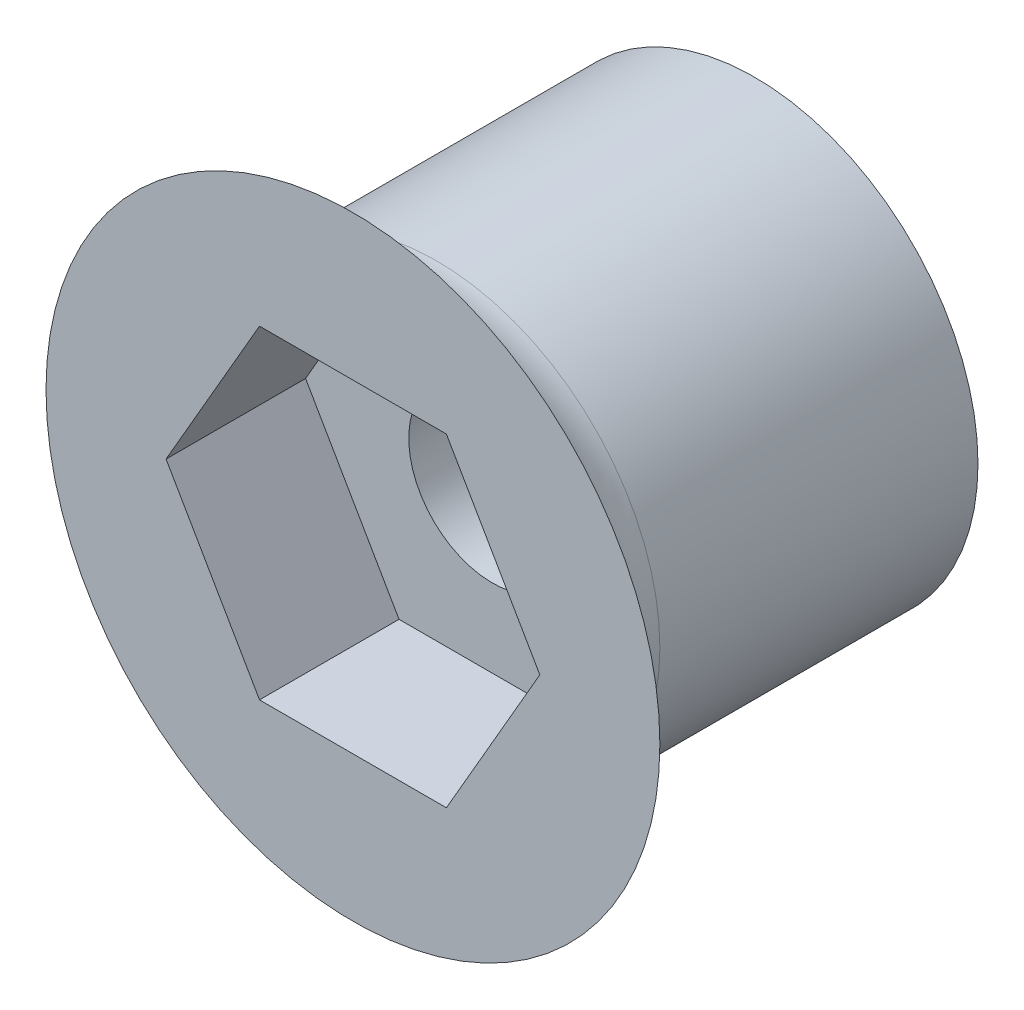
from build123d import *

# Parameters (mm, degrees)
CUT_EXTRUDE1_DEPTH = 2.5


with BuildPart() as part:
    # Sketch1 → Revolve1 (revolve)
    with BuildSketch(Plane(origin=(0, 0, 0), x_dir=(1, 0, 0), z_dir=(0, 1, 0)), mode=Mode.PRIVATE) as revolve1_sk:
        with BuildLine():
            Line((-1.5, 0), (-4, 0))
            Line((-4, 0), (-5.5, 0))
            ThreePointArc((-5.5, 0), (-4.439339828, 0.439339828), (-4, 1.5))
            Line((-4, 1.5), (-4, 7.2))
            Line((-4, 7.2), (-1.5, 7.2))
            Line((-1.5, 7.2), (-1.5, 0))
        make_face()
    revolve(revolve1_sk.sketch.rotate(Axis((0, 0, 0), (0, 0, -1)), 180), axis=Axis((0, 0, 0), (0, 0, -1)))

    # Sketch2 → Cut-Extrude1 (cut)
    with BuildSketch(Plane.XY):
        Polygon((1.674315781, 2.9), (-1.674315781, 2.9), (-3.348631561, 0), (-1.674315781, -2.9), (1.674315781, -2.9), (3.348631561, 0), align=None)
    extrude(amount=-CUT_EXTRUDE1_DEPTH, mode=Mode.SUBTRACT)


solid = part.part
